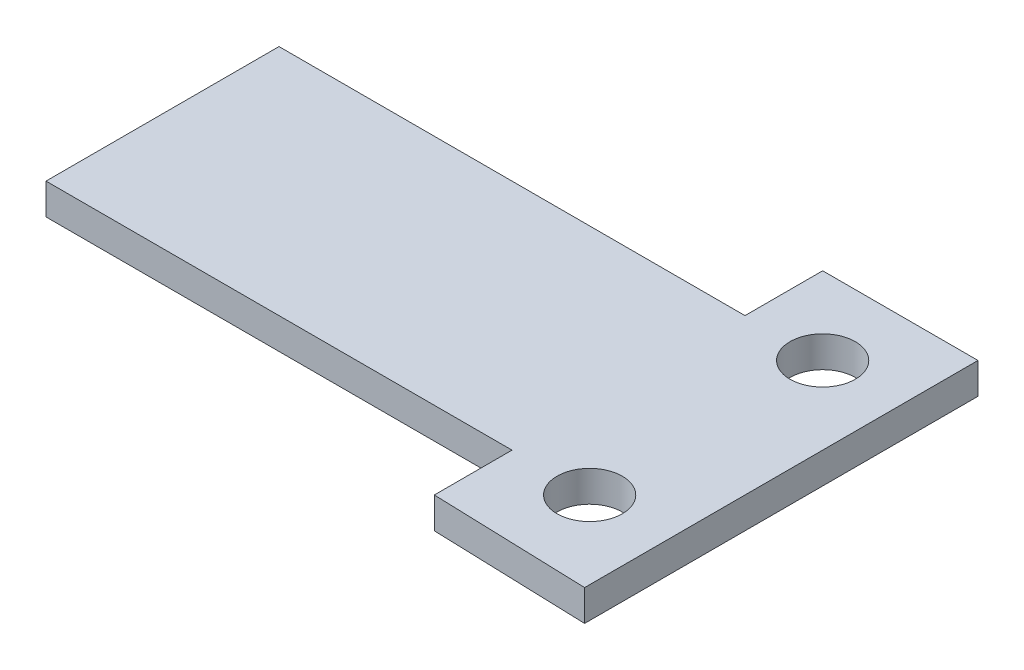
from build123d import *

# Parameters (mm, degrees)
SKETCH_1_R      = 2.1
EXTRUDE_1_DEPTH = 2


with BuildPart() as part:
    # 草图1 → 凸台-拉伸1 (new body)
    with BuildSketch(Plane(origin=(0, 0, 0), x_dir=(1, 0, 0), z_dir=(0, 1, 0))):
        Polygon((-5, 12.5), (5, 12.5), (5, -12.826386435), (-5, -12.5), (-5, -7.5), (-35, -7.5), (-35, 7.5), (-5, 7.5), align=None)
        with Locations(Location((0, 7.5, 0), (0, 0, 270))):
            Circle(SKETCH_1_R, mode=Mode.SUBTRACT)
        with Locations(Location((0, -7.5, 0), (0, 0, 270))):
            Circle(SKETCH_1_R, mode=Mode.SUBTRACT)
    extrude(amount=EXTRUDE_1_DEPTH)


solid = part.part
